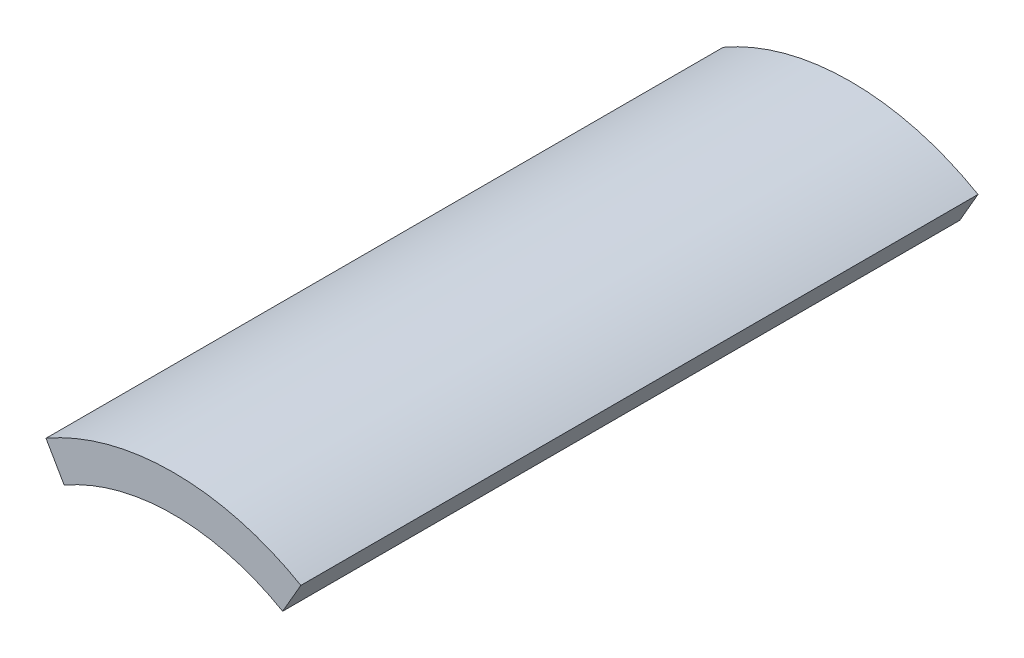
from build123d import *

# Parameters (mm, degrees)
BOSS_EXTRUDE1_DEPTH = 59.055


with BuildPart() as part:
    # Sketch1 → Boss-Extrude1 (new body)
    with BuildSketch(Plane.XY):
        with BuildLine():
            ThreePointArc((-11.1125, 19.247414599), (0, 22.225), (11.1125, 19.247414599))
            Line((11.1125, 19.247414599), (9.525, 16.497783942))
            ThreePointArc((9.525, 16.497783942), (0, 19.05), (-9.525, 16.497783942))
            Line((-9.525, 16.497783942), (-11.1125, 19.247414599))
        make_face()
    extrude(amount=BOSS_EXTRUDE1_DEPTH)


solid = part.part
